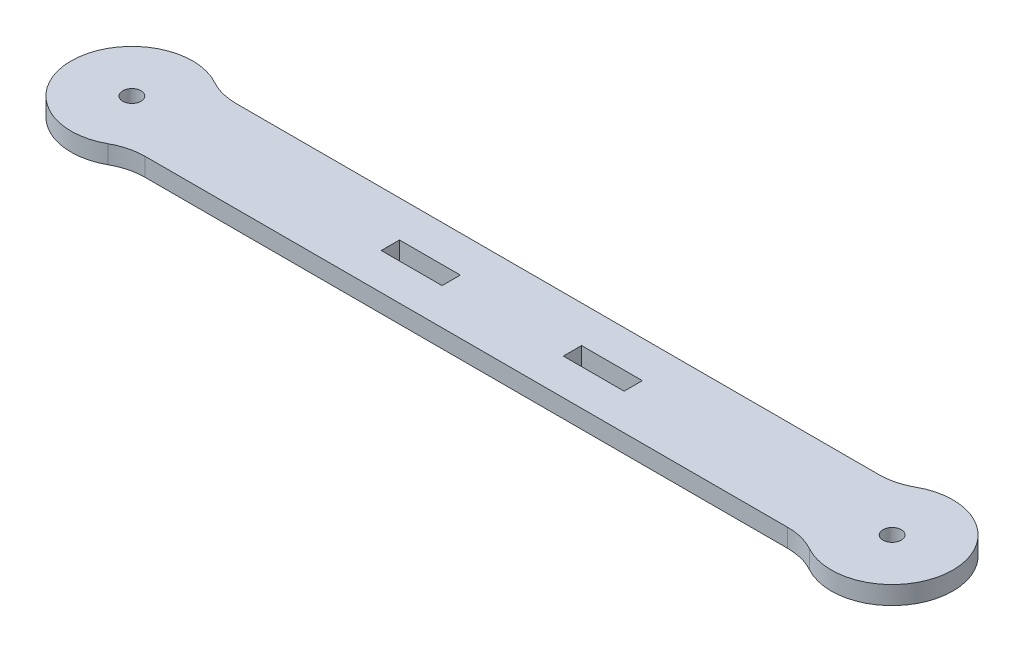
from build123d import *

# Parameters (mm, degrees)
SKETCH_1_R      = 1.5
SKETCH_1_W      = 10
SKETCH_1_H      = 3
EXTRUDE_1_DEPTH = 3
FILLET_1_R      = 10


with BuildPart() as part:
    # 草图1 → 凸台-拉伸1 (new body)
    with BuildSketch(Plane(origin=(0, 0, 0), x_dir=(1, 0, 0), z_dir=(0, 1, 0))):
        with BuildLine():
            Line((-55.885621722, -7.5), (55.885621722, -7.5))
            ThreePointArc((55.885621722, -7.5), (72.5, 0), (55.885621722, 7.5))
            Line((55.885621722, 7.5), (-55.885621722, 7.5))
            ThreePointArc((-55.885621722, 7.5), (-72.5, 0), (-55.885621722, -7.5))
        make_face()
        with Locations(Location((-62.5, 0, 0), (0, 0, 270))):
            Circle(SKETCH_1_R, mode=Mode.SUBTRACT)
        with Locations(Location((62.5, 0, 0), (0, 0, 270))):
            Circle(SKETCH_1_R, mode=Mode.SUBTRACT)
        with Locations((-15, 0)):
            Rectangle(SKETCH_1_W, SKETCH_1_H, mode=Mode.SUBTRACT)
        with Locations((15, -0.064058726)):
            Rectangle(SKETCH_1_W, SKETCH_1_H, mode=Mode.SUBTRACT)
    extrude(amount=EXTRUDE_1_DEPTH)

    # 圆角1
    fillet_1_edges = [part.edges().sort_by_distance(p)[0] for p in [
        (-55.885621722, 1.5, -7.5),
        (55.885621722, 1.5, -7.5),
        (55.885621722, 1.5, 7.5),
        (-55.885621722, 1.5, 7.5),
    ]]
    fillet(fillet_1_edges, radius=FILLET_1_R)


solid = part.part
